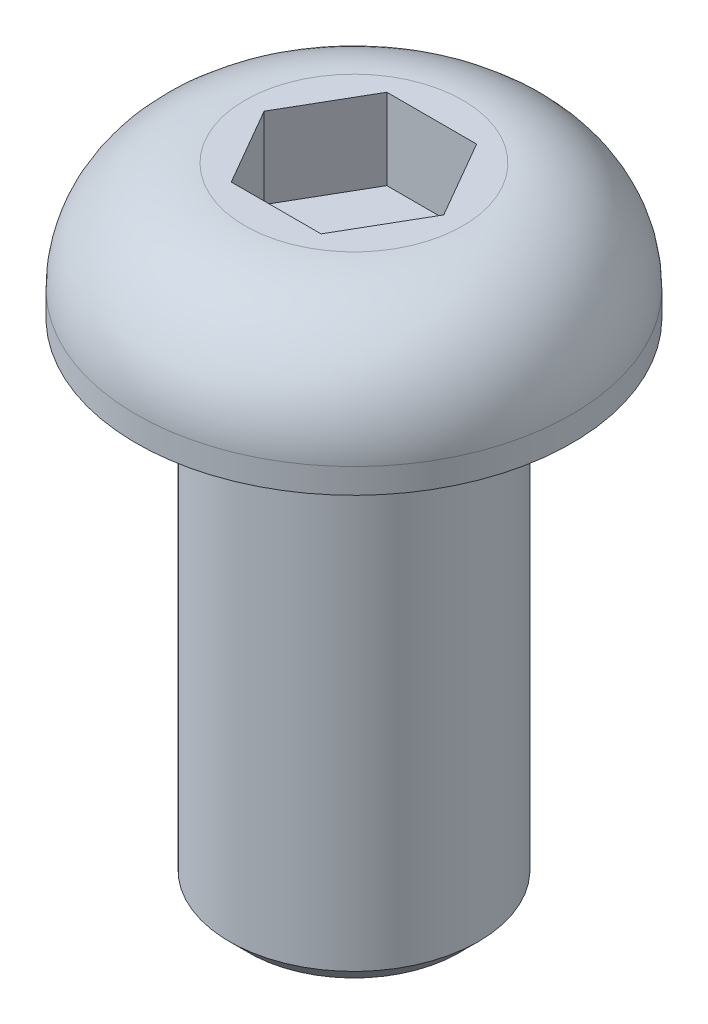
from build123d import *

# Parameters (mm, degrees)
CUT_EXTRUDE1_DEPTH = 2.6
FILLET1_R          = 0.4
CHAMFER1_SIZE      = 0.625


with BuildPart() as part:
    # Sketch1 → Revolve1 (revolve)
    with BuildSketch(Plane.XY, mode=Mode.PRIVATE) as revolve1_sk:
        with BuildLine():
            Line((0, 0), (3.5, 0))
            ThreePointArc((3.5, 0), (5.974873734, -1.025126266), (7, -3.5))
            Line((7, -3.5), (7, -4.3))
            Line((7, -4.3), (4, -4.3))
            Line((4, -4.3), (4, -20.3))
            Line((4, -20.3), (0, -20.3))
            Line((0, -20.3), (0, 0))
        make_face()
    revolve(revolve1_sk.sketch.rotate(Axis((0, 5, 0), (0, -1, 0)), 180), axis=Axis((0, 5, 0), (0, -1, 0)))

    # Sketch2 → Cut-Extrude1 (cut)
    with BuildSketch(Plane(origin=(0, 0, 0), x_dir=(1, 0, 0), z_dir=(0, 1, 0))):
        Polygon((2.886751346, 0), (1.443375673, 2.5), (-1.443375673, 2.5), (-2.886751346, 0), (-1.443375673, -2.5), (1.443375673, -2.5), align=None)
    extrude(amount=-CUT_EXTRUDE1_DEPTH, mode=Mode.SUBTRACT)

    # Fillet1
    fillet1_edges = [part.edges().sort_by_distance(p)[0] for p in [
        (4, -4.3, 0),
    ]]
    fillet(fillet1_edges, radius=FILLET1_R)

    # Chamfer1
    chamfer1_edges = [part.edges().sort_by_distance(p)[0] for p in [
        (4, -20.3, 0),
    ]]
    chamfer(chamfer1_edges, length=CHAMFER1_SIZE)


solid = part.part
